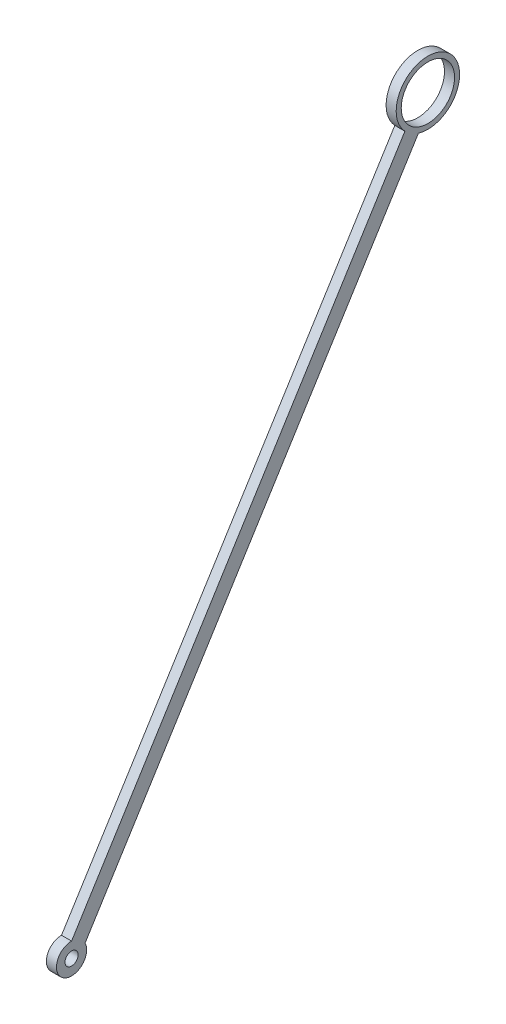
from build123d import *

# Parameters (mm, degrees)
SKETCH1_R           = 2.65
SKETCH1_R_2         = 0.65
BOSS_EXTRUDE1_DEPTH = 1


with BuildPart() as part:
    # Sketch1 → Boss-Extrude1 (new body)
    with BuildSketch(Plane.ZY.offset(-16.004809472)):
        with BuildLine():
            Line((43.488619522, 61.406385053), (10.382219934, 114.514122983))
            ThreePointArc((10.382219934, 114.514122983), (6.429799658, 119.354410747), (9.035439795, 113.674564697))
            Line((9.035439795, 113.674564697), (42.141839383, 60.566826767))
            ThreePointArc((42.141839383, 60.566826767), (44.282136198, 58.633462713), (43.488619522, 61.406385053))
        make_face()
        with Locations((8.096184677, 116.681273832)):
            Circle(SKETCH1_R, mode=Mode.SUBTRACT)
        with Locations((43.488619522, 59.906385053)):
            Circle(SKETCH1_R_2, mode=Mode.SUBTRACT)
    extrude(amount=BOSS_EXTRUDE1_DEPTH)


solid = part.part
